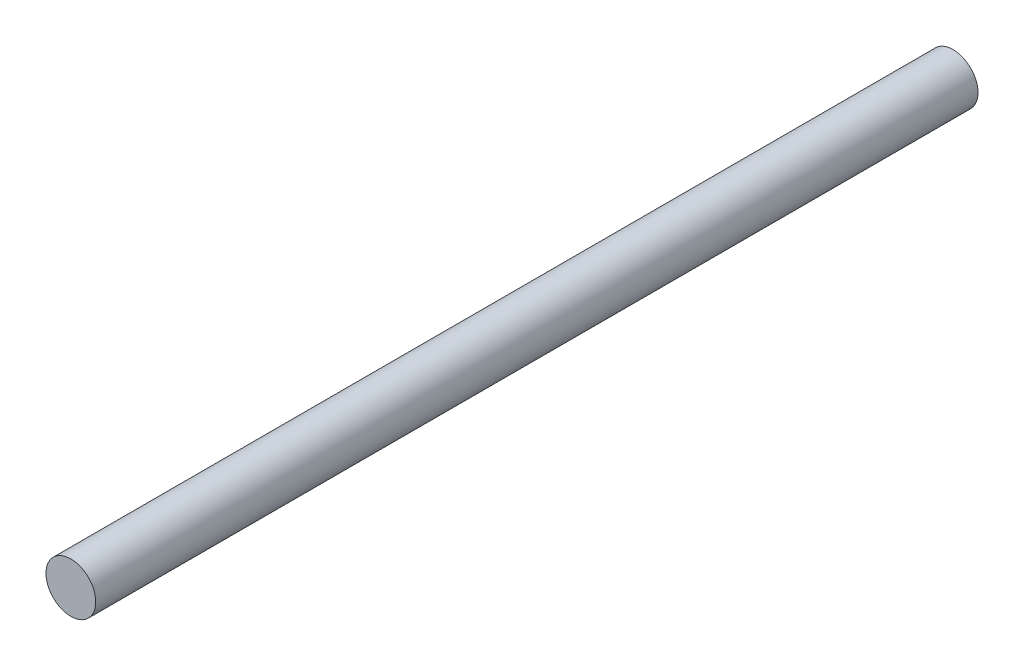
from build123d import *

# Parameters (mm, degrees)
SKETCH2_R           = 6.35
BOSS_EXTRUDE1_DEPTH = 225


with BuildPart() as part:
    # Sketch2 → Boss-Extrude1 (new body)
    with BuildSketch(Plane.XY):
        Circle(SKETCH2_R)
    extrude(amount=BOSS_EXTRUDE1_DEPTH)


solid = part.part
